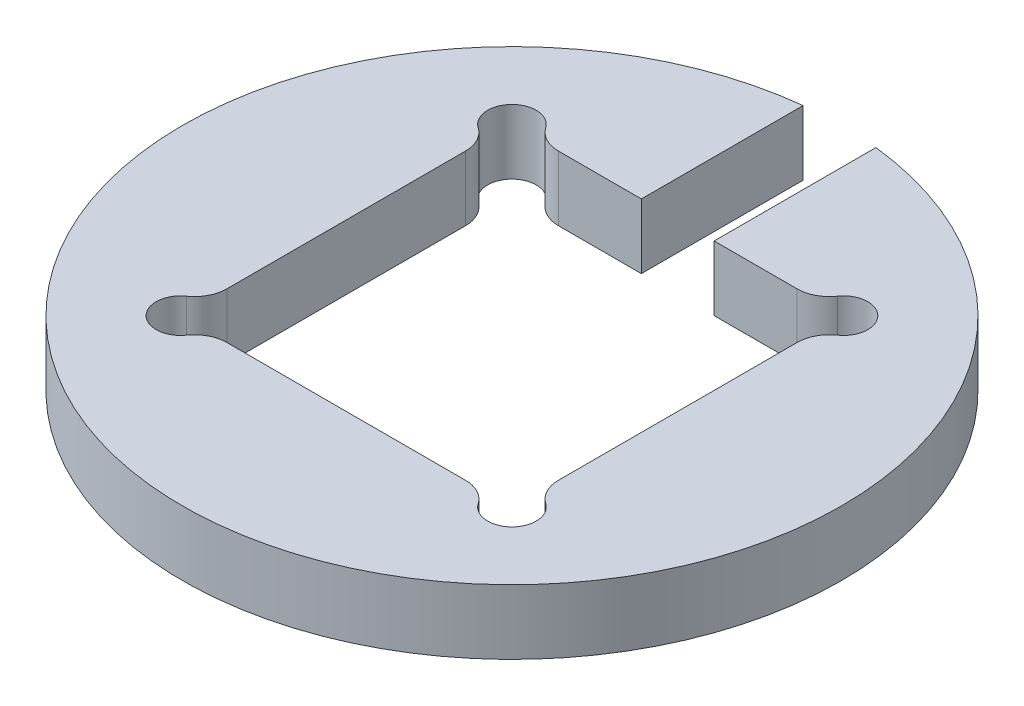
from build123d import *

# Parameters (mm, degrees)
BOSS_EXTRUDE1_DEPTH = 4
FILLET1_R           = 2


with BuildPart() as part:
    # Sketch1 → Boss-Extrude1 (new body)
    with BuildSketch(Plane(origin=(0, 0, 0), x_dir=(1, 0, 0), z_dir=(0, 1, 0))):
        with BuildLine():
            ThreePointArc((1.5, 0), (-1.060660172, -1.060660172), (0, 1.5))
            Line((0, 1.5), (0, 19))
            ThreePointArc((0, 19), (-1.060660172, 21.560660172), (1.5, 20.5))
            Line((1.5, 20.5), (8, 20.5))
            Line((8, 20.5), (8, 30.5))
            ThreePointArc((8, 30.5), (10.25, -10.124616561), (12.5, 30.5))
            Line((12.5, 30.5), (12.5, 20.5))
            Line((12.5, 20.5), (19, 20.5))
            ThreePointArc((19, 20.5), (21.560660172, 21.560660172), (20.5, 19))
            Line((20.5, 19), (20.5, 1.5))
            ThreePointArc((20.5, 1.5), (21.560660172, -1.060660172), (19, 0))
            Line((19, 0), (1.5, 0))
        make_face()
    extrude(amount=BOSS_EXTRUDE1_DEPTH)

    # Fillet1
    fillet1_edges = [part.edges().sort_by_distance(p)[0] for p in [
        (0, 2, -19),
        (0, 2, -1.5),
        (1.5, 2, 0),
        (19, 2, 0),
        (20.5, 2, -1.5),
        (20.5, 2, -19),
        (19, 2, -20.5),
        (1.5, 2, -20.5),
    ]]
    fillet(fillet1_edges, radius=FILLET1_R)


solid = part.part
